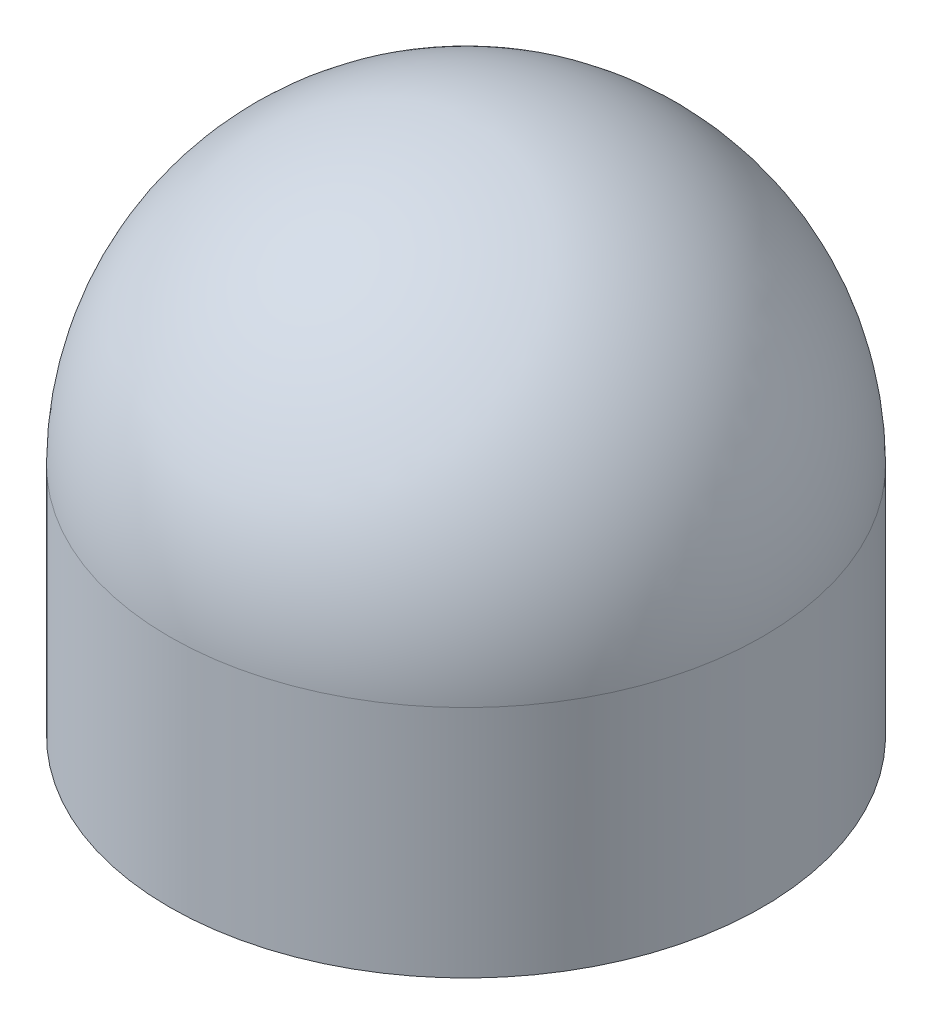
from build123d import *


with BuildPart() as part:
    # Sketch1 → Revolve1 (revolve)
    with BuildSketch(Plane.XY, mode=Mode.PRIVATE) as revolve1_sk:
        with BuildLine():
            Line((0, 17.272), (0, 7.62))
            Line((0, 7.62), (0, 0))
            Line((0, 0), (9.652, 0))
            Line((9.652, 0), (9.652, 7.62))
            ThreePointArc((9.652, 7.62), (6.824994652, 14.444994652), (0, 17.272))
        make_face()
    revolve(revolve1_sk.sketch.rotate(Axis((0, 17.272, 0), (0, -1, 0)), 90), axis=Axis((0, 17.272, 0), (0, -1, 0)))


solid = part.part
